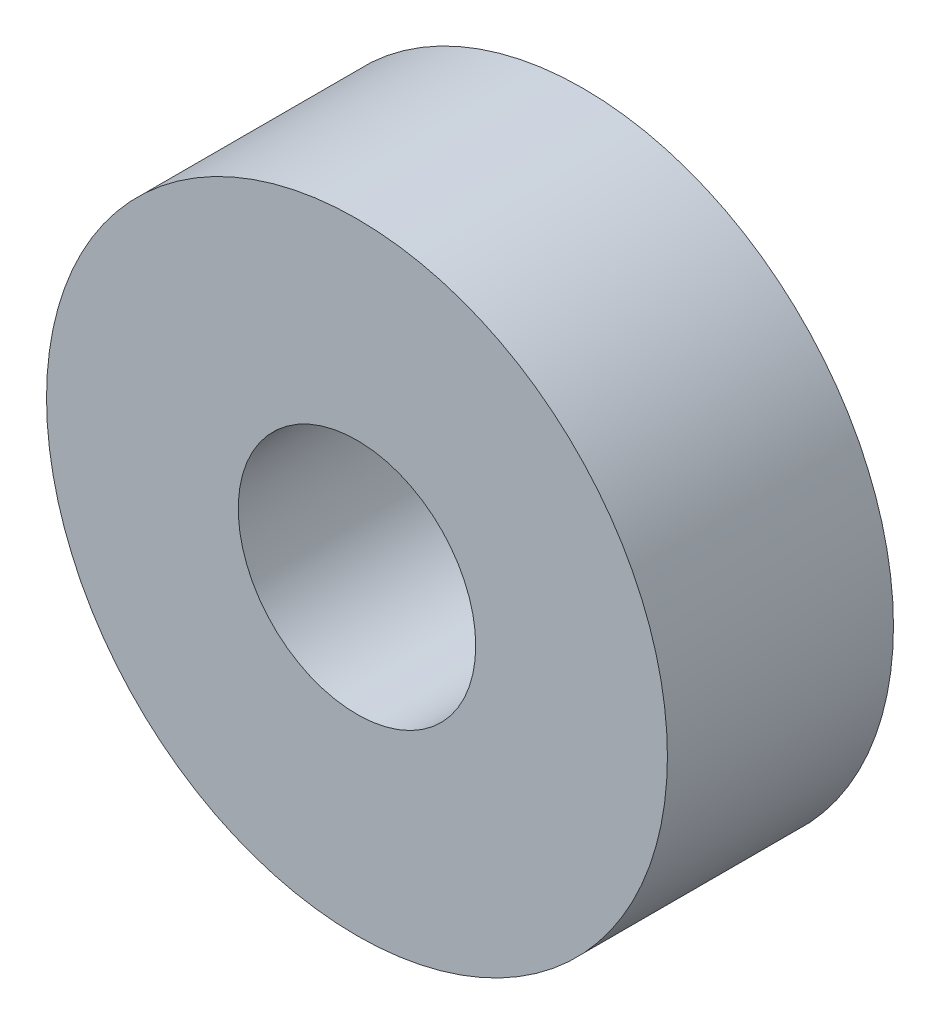
from build123d import *

# Parameters (mm, degrees)
SKETCH1_R           = 10.85
SKETCH1_R_2         = 4.15
BOSS_EXTRUDE1_DEPTH = 7.9


with BuildPart() as part:
    # Sketch1 → Boss-Extrude1 (new body)
    with BuildSketch(Plane.XY):
        Circle(SKETCH1_R)
        Circle(SKETCH1_R_2, mode=Mode.SUBTRACT)
    extrude(amount=BOSS_EXTRUDE1_DEPTH)


solid = part.part
